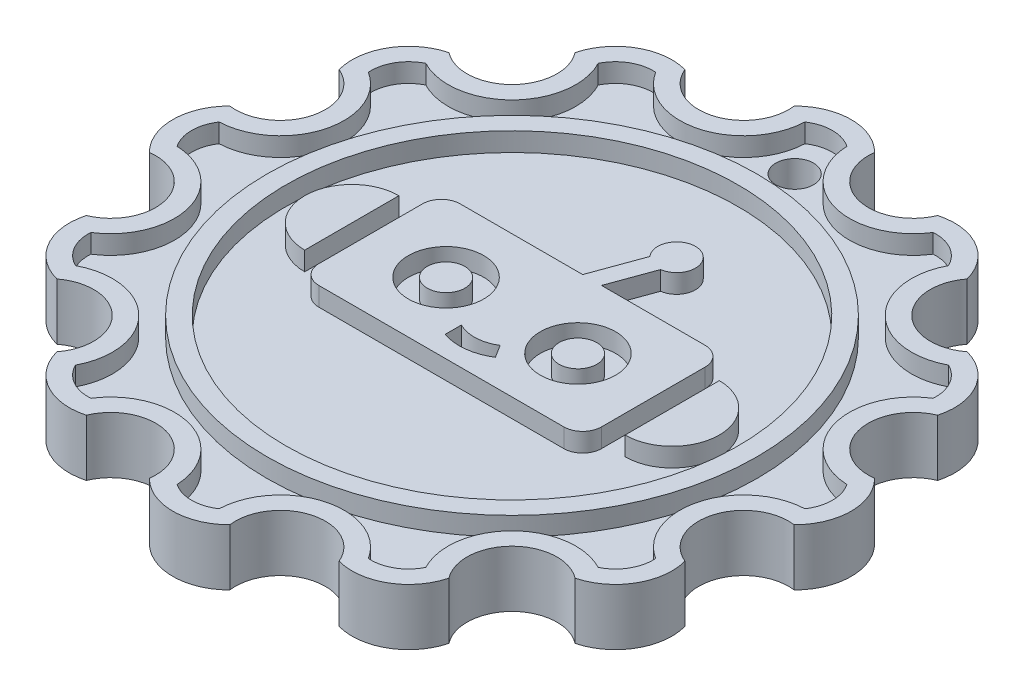
from build123d import *

# Parameters (mm, degrees)
BOSS_EXTRUDE1_DEPTH = 4
BOSS_EXTRUDE3_DEPTH = 2
CUT_EXTRUDE1_DEPTH  = 2
SKETCH2_R           = 26
SKETCH2_R_2         = 24
BOSS_EXTRUDE4_DEPTH = 2
SKETCH5_W           = 30
SKETCH5_H           = 15
SKETCH5_R           = 4
SKETCH5_R_2         = 2
BOSS_EXTRUDE5_DEPTH = 2
BOSS_EXTRUDE6_DEPTH = 2
CUT_EXTRUDE2_DEPTH  = 2
SKETCH8_R           = 2
CUT_EXTRUDE3_DEPTH  = 6
FILLET1_R           = 2


with BuildPart() as part:
    # Sketch1 → Boss-Extrude1 (new body)
    with BuildSketch(Plane(origin=(0, 0, 0), x_dir=(1, 0, 0), z_dir=(0, 1, 0))):
        with BuildLine():
            ThreePointArc((31.766819559, 13.412064474), (28.977774789, 7.764571353), (34.216904973, 4.268221228))
            ThreePointArc((34.216904973, 4.268221228), (36, 0), (34.216904973, -4.268221228))
            ThreePointArc((34.216904973, -4.268221228), (28.977774789, -7.764571353), (31.766819559, -13.412064474))
            ThreePointArc((31.766819559, -13.412064474), (31.176914536, -18), (27.498598332, -20.804840499))
            ThreePointArc((27.498598332, -20.804840499), (21.213203436, -21.213203436), (20.804840499, -27.498598332))
            ThreePointArc((20.804840499, -27.498598332), (18, -31.176914536), (13.412064474, -31.766819559))
            ThreePointArc((13.412064474, -31.766819559), (7.764571353, -28.977774789), (4.268221228, -34.216904973))
            ThreePointArc((4.268221228, -34.216904973), (0, -36), (-4.268221228, -34.216904973))
            ThreePointArc((-4.268221228, -34.216904973), (-7.764571353, -28.977774789), (-13.412064474, -31.766819559))
            ThreePointArc((-13.412064474, -31.766819559), (-18, -31.176914536), (-20.804840499, -27.498598332))
            ThreePointArc((-20.804840499, -27.498598332), (-21.213203436, -21.213203436), (-27.498598332, -20.804840499))
            ThreePointArc((-27.498598332, -20.804840499), (-31.176914536, -18), (-31.766819559, -13.412064474))
            ThreePointArc((-31.766819559, -13.412064474), (-28.977774789, -7.764571353), (-34.216904973, -4.268221228))
            ThreePointArc((-34.216904973, -4.268221228), (-36, 0), (-34.216904973, 4.268221228))
            ThreePointArc((-34.216904973, 4.268221228), (-28.977774789, 7.764571353), (-31.766819559, 13.412064474))
            ThreePointArc((-31.766819559, 13.412064474), (-31.176914536, 18), (-27.498598332, 20.804840499))
            ThreePointArc((-27.498598332, 20.804840499), (-21.213203436, 21.213203436), (-20.804840499, 27.498598332))
            ThreePointArc((-20.804840499, 27.498598332), (-18, 31.176914536), (-13.412064474, 31.766819559))
            ThreePointArc((-13.412064474, 31.766819559), (-7.764571353, 28.977774789), (-4.268221228, 34.216904973))
            ThreePointArc((-4.268221228, 34.216904973), (0, 36), (4.268221228, 34.216904973))
            ThreePointArc((4.268221228, 34.216904973), (7.764571353, 28.977774789), (13.412064474, 31.766819559))
            ThreePointArc((13.412064474, 31.766819559), (18, 31.176914536), (20.804840499, 27.498598332))
            ThreePointArc((20.804840499, 27.498598332), (21.213203436, 21.213203436), (27.498598332, 20.804840499))
            ThreePointArc((27.498598332, 20.804840499), (31.176914536, 18), (31.766819559, 13.412064474))
        make_face()
    extrude(amount=BOSS_EXTRUDE1_DEPTH)

    # Sketch4 → Boss-Extrude3 (add)
    with BuildSketch(Plane(origin=(0, 4, 0), x_dir=(1, 0, 0), z_dir=(0, 1, 0))):
        with BuildLine():
            ThreePointArc((-13.412064474, 31.766819559), (-18, 31.176914536), (-20.804840499, 27.498598332))
            ThreePointArc((-20.804840499, 27.498598332), (-21.213203436, 21.213203436), (-27.498598332, 20.804840499))
            ThreePointArc((-27.498598332, 20.804840499), (-31.176914536, 18), (-31.766819559, 13.412064474))
            ThreePointArc((-31.766819559, 13.412064474), (-28.977774789, 7.764571353), (-34.216904973, 4.268221228))
            ThreePointArc((-34.216904973, 4.268221228), (-36, 0), (-34.216904973, -4.268221228))
            ThreePointArc((-34.216904973, -4.268221228), (-28.977774789, -7.764571353), (-31.766819559, -13.412064474))
            ThreePointArc((-31.766819559, -13.412064474), (-31.176914536, -18), (-27.498598332, -20.804840499))
            ThreePointArc((-27.498598332, -20.804840499), (-21.213203436, -21.213203436), (-20.804840499, -27.498598332))
            ThreePointArc((-20.804840499, -27.498598332), (-18, -31.176914536), (-13.412064474, -31.766819559))
            ThreePointArc((-13.412064474, -31.766819559), (-7.764571353, -28.977774789), (-4.268221228, -34.216904973))
            ThreePointArc((-4.268221228, -34.216904973), (0, -36), (4.268221228, -34.216904973))
            ThreePointArc((4.268221228, -34.216904973), (7.764571353, -28.977774789), (13.412064474, -31.766819559))
            ThreePointArc((13.412064474, -31.766819559), (18, -31.176914536), (20.804840499, -27.498598332))
            ThreePointArc((20.804840499, -27.498598332), (21.213203436, -21.213203436), (27.498598332, -20.804840499))
            ThreePointArc((27.498598332, -20.804840499), (31.176914536, -18), (31.766819559, -13.412064474))
            ThreePointArc((31.766819559, -13.412064474), (28.977774789, -7.764571353), (34.216904973, -4.268221228))
            ThreePointArc((34.216904973, -4.268221228), (36, 0), (34.216904973, 4.268221228))
            ThreePointArc((34.216904973, 4.268221228), (28.977774789, 7.764571353), (31.766819559, 13.412064474))
            ThreePointArc((31.766819559, 13.412064474), (31.176914536, 18), (27.498598332, 20.804840499))
            ThreePointArc((27.498598332, 20.804840499), (21.213203436, 21.213203436), (20.804840499, 27.498598332))
            ThreePointArc((20.804840499, 27.498598332), (18, 31.176914536), (13.412064474, 31.766819559))
            ThreePointArc((13.412064474, 31.766819559), (7.764571353, 28.977774789), (4.268221228, 34.216904973))
            ThreePointArc((4.268221228, 34.216904973), (0, 36), (-4.268221228, 34.216904973))
            ThreePointArc((-4.268221228, 34.216904973), (-7.764571353, 28.977774789), (-13.412064474, 31.766819559))
        make_face()
    extrude(amount=BOSS_EXTRUDE3_DEPTH)

    # Sketch3 → Cut-Extrude1 (cut)
    with BuildSketch(Plane(origin=(0, 4, 0), x_dir=(1, 0, 0), z_dir=(0, 1, 0))):
        with BuildLine():
            ThreePointArc((-14.726691345, 29.971413987), (-17, 29.444863729), (-18.592660228, 27.739395812))
            ThreePointArc((-18.592660228, 27.739395812), (-19.798989873, 19.798989873), (-27.739395812, 18.592660228))
            ThreePointArc((-27.739395812, 18.592660228), (-29.444863729, 17), (-29.971413987, 14.726691345))
            ThreePointArc((-29.971413987, 14.726691345), (-27.045923136, 7.246933263), (-33.319351573, 2.232018175))
            ThreePointArc((-33.319351573, 2.232018175), (-34, 0), (-33.319351573, -2.232018175))
            ThreePointArc((-33.319351573, -2.232018175), (-27.045923136, -7.246933263), (-29.971413987, -14.726691345))
            ThreePointArc((-29.971413987, -14.726691345), (-29.444863729, -17), (-27.739395812, -18.592660228))
            ThreePointArc((-27.739395812, -18.592660228), (-19.798989873, -19.798989873), (-18.592660228, -27.739395812))
            ThreePointArc((-18.592660228, -27.739395812), (-17, -29.444863729), (-14.726691345, -29.971413987))
            ThreePointArc((-14.726691345, -29.971413987), (-7.246933263, -27.045923136), (-2.232018175, -33.319351573))
            ThreePointArc((-2.232018175, -33.319351573), (0, -34), (2.232018175, -33.319351573))
            ThreePointArc((2.232018175, -33.319351573), (7.246933263, -27.045923136), (14.726691345, -29.971413987))
            ThreePointArc((14.726691345, -29.971413987), (17, -29.444863729), (18.592660228, -27.739395812))
            ThreePointArc((18.592660228, -27.739395812), (19.798989873, -19.798989873), (27.739395812, -18.592660228))
            ThreePointArc((27.739395812, -18.592660228), (29.444863729, -17), (29.971413987, -14.726691345))
            ThreePointArc((29.971413987, -14.726691345), (27.045923136, -7.246933263), (33.319351573, -2.232018175))
            ThreePointArc((33.319351573, -2.232018175), (34, 0), (33.319351573, 2.232018175))
            ThreePointArc((33.319351573, 2.232018175), (27.045923136, 7.246933263), (29.971413987, 14.726691345))
            ThreePointArc((29.971413987, 14.726691345), (29.444863729, 17), (27.739395812, 18.592660228))
            ThreePointArc((27.739395812, 18.592660228), (19.798989873, 19.798989873), (18.592660228, 27.739395812))
            ThreePointArc((18.592660228, 27.739395812), (17, 29.444863729), (14.726691345, 29.971413987))
            ThreePointArc((14.726691345, 29.971413987), (7.246933263, 27.045923136), (2.232018175, 33.319351573))
            ThreePointArc((2.232018175, 33.319351573), (0, 34), (-2.232018175, 33.319351573))
            ThreePointArc((-2.232018175, 33.319351573), (-7.246933263, 27.045923136), (-14.726691345, 29.971413987))
        make_face()
    extrude(amount=CUT_EXTRUDE1_DEPTH, mode=Mode.SUBTRACT)

    # Sketch2 → Boss-Extrude4 (add)
    with BuildSketch(Plane(origin=(0, 4, 0), x_dir=(1, 0, 0), z_dir=(0, 1, 0))):
        with Locations(Location((0, 0, 0), (0, 0, 270))):
            Circle(SKETCH2_R)
        with Locations(Location((0, 0, 0), (0, 0, 270))):
            Circle(SKETCH2_R_2, mode=Mode.SUBTRACT)
    extrude(amount=BOSS_EXTRUDE4_DEPTH)

    # Sketch5 → Boss-Extrude5 (add)
    # profile 1 of 5: a face of its own
    with BuildSketch(Plane(origin=(0, 4, 0), x_dir=(1, 0, 0), z_dir=(0, 1, 0))):
        with BuildLine():
            Line((-17, 5), (-17, -5))
            ThreePointArc((-17, -5), (-22, 0), (-17, 5))
        make_face()
    # profile 2 of 5: a face of its own
    with BuildSketch(Plane(origin=(0, 4, 0), x_dir=(1, 0, 0), z_dir=(0, 1, 0))):
        Rectangle(SKETCH5_W, SKETCH5_H)
        with Locations(Location((-7, 0, 0), (0, 0, 270))):
            Circle(SKETCH5_R, mode=Mode.SUBTRACT)
        with Locations(Location((7, 0, 0), (0, 0, 270))):
            Circle(SKETCH5_R, mode=Mode.SUBTRACT)
    # profile 3 of 5: a face of its own
    with BuildSketch(Plane(origin=(0, 4, 0), x_dir=(1, 0, 0), z_dir=(0, 1, 0))):
        with Locations(Location((-7, 0, 0), (0, 0, 270))):
            Circle(SKETCH5_R_2)
    # profile 4 of 5: a face of its own
    with BuildSketch(Plane(origin=(0, 4, 0), x_dir=(1, 0, 0), z_dir=(0, 1, 0))):
        with Locations(Location((7, 0, 0), (0, 0, 270))):
            Circle(SKETCH5_R_2)
    # profile 5 of 5: a face of its own
    with BuildSketch(Plane(origin=(0, 4, 0), x_dir=(1, 0, 0), z_dir=(0, 1, 0))):
        with BuildLine():
            ThreePointArc((17, 5), (22, 0), (17, -5))
            Line((17, -5), (17, 5))
        make_face()
    extrude(amount=BOSS_EXTRUDE5_DEPTH)

    # Sketch6 → Boss-Extrude6 (add)
    with BuildSketch(Plane(origin=(0, 4, 0), x_dir=(1, 0, 0), z_dir=(0, 1, 0))):
        with BuildLine():
            Line((0, 7.5), (1.907283427, 12.740218147))
            ThreePointArc((1.907283427, 12.740218147), (4.07818129, 15.957233587), (3.67332787, 12.097430538))
            Line((3.67332787, 12.097430538), (2, 7.5))
            Line((2, 7.5), (0, 7.5))
        make_face()
    extrude(amount=BOSS_EXTRUDE6_DEPTH)

    # Sketch7 → Cut-Extrude2 (cut)
    with BuildSketch(Plane(origin=(0, 6, 0), x_dir=(1, 0, 0), z_dir=(0, 1, 0))):
        with BuildLine():
            Line((2.126154469, -3.388136239), (2.510116854, -4))
            Line((2.510116854, -4), (2.973799982, -4.738902857))
            ThreePointArc((2.973799982, -4.738902857), (0.649911516, -5.55682478), (-1.8, -5.297233865))
            Line((-1.8, -5.297233865), (-1.8, -3.57211422))
            ThreePointArc((-1.8, -3.57211422), (0.1872329, -3.995615577), (2.126154469, -3.388136239))
        make_face()
    extrude(amount=-CUT_EXTRUDE2_DEPTH, mode=Mode.SUBTRACT)

    # Sketch8 → Cut-Extrude3 (cut)
    with BuildSketch(Plane(origin=(0, 4, 0), x_dir=(1, 0, 0), z_dir=(0, 1, 0))):
        with Locations(Location((0, 30, 0), (0, 0, 270))):
            Circle(SKETCH8_R)
    extrude(amount=-CUT_EXTRUDE3_DEPTH, mode=Mode.SUBTRACT)

    # Fillet1
    fillet1_edges = [part.edges().sort_by_distance(p)[0] for p in [
        (-15, 5, 7.5),
        (15, 5, 7.5),
        (15, 5, -7.5),
        (-15, 5, -7.5),
    ]]
    fillet(fillet1_edges, radius=FILLET1_R)


solid = part.part
